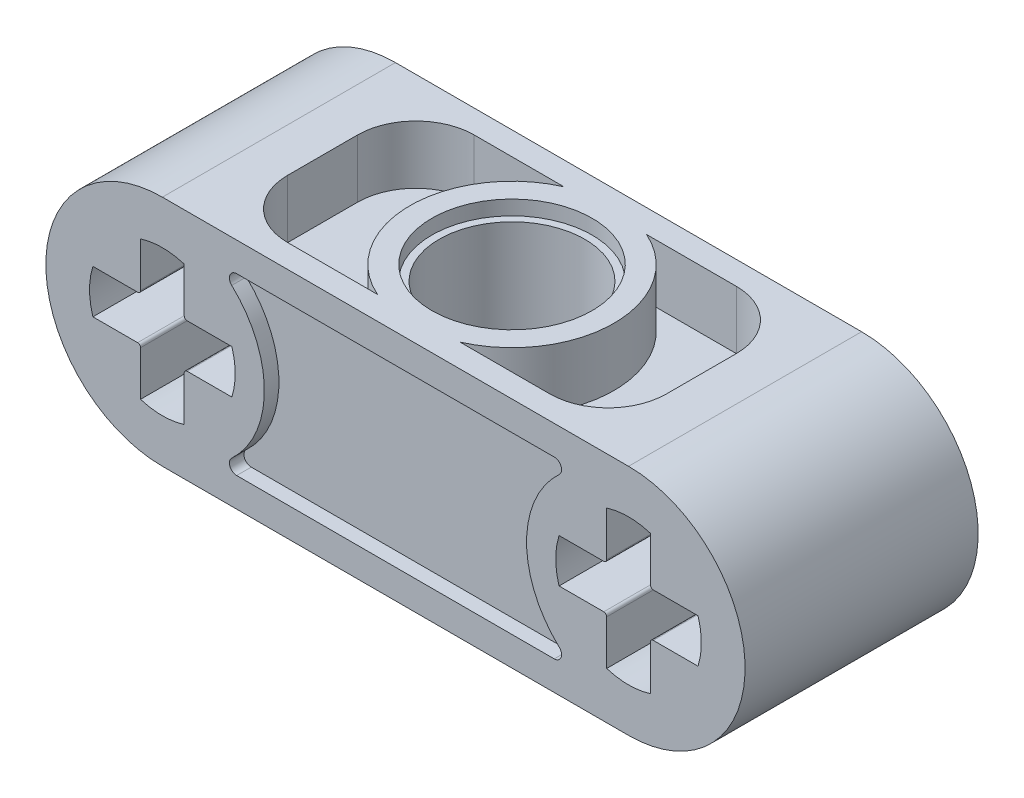
from build123d import *

# Parameters (mm, degrees)
EXTRUIR1_DEPTH         = 4
CROQUIS2_R             = 2.5
CORTAR_EXTRUIR1_DEPTH  = 15.966629547
CROQUIS3_R             = 2.75
CORTAR_EXTRUIR2_DEPTH  = 0.5
CORTAR_EXTRUIR3_DEPTH  = 2
SIMETR_A3_COPY_1_DEPTH = 2
REDONDEO1_R            = 2
CORTAR_EXTRUIR4_DEPTH  = 0.5


with BuildPart() as part:
    # Croquis1 → Extruir1 (new, symmetric)
    with BuildSketch(Plane.XY):
        with BuildLine():
            Line((-8, 4), (8, 4))
            ThreePointArc((8, 4), (12, 0), (8, -4))
            Line((8, -4), (-8, -4))
            ThreePointArc((-8, -4), (-12, 0), (-8, 4))
        make_face()
        with BuildLine():
            Line((10.384848004, -0.75), (8.85, -0.75))
            ThreePointArc((8.85, -0.75), (8.779289322, -0.779289322), (8.75, -0.85))
            Line((8.75, -0.85), (8.75, -2.384848004))
            ThreePointArc((8.75, -2.384848004), (8, -2.5), (7.25, -2.384848004))
            Line((7.25, -2.384848004), (7.25, -0.85))
            ThreePointArc((7.25, -0.85), (7.220710678, -0.779289322), (7.15, -0.75))
            Line((7.15, -0.75), (5.615151996, -0.75))
            ThreePointArc((5.615151996, -0.75), (5.5, 0), (5.615151996, 0.75))
            Line((5.615151996, 0.75), (7.15, 0.75))
            ThreePointArc((7.15, 0.75), (7.220710678, 0.779289322), (7.25, 0.85))
            Line((7.25, 0.85), (7.25, 2.384848004))
            ThreePointArc((7.25, 2.384848004), (8, 2.5), (8.75, 2.384848004))
            Line((8.75, 2.384848004), (8.75, 0.85))
            ThreePointArc((8.75, 0.85), (8.779289322, 0.779289322), (8.85, 0.75))
            Line((8.85, 0.75), (10.384848004, 0.75))
            ThreePointArc((10.384848004, 0.75), (10.5, 0), (10.384848004, -0.75))
        make_face(mode=Mode.SUBTRACT)
        with BuildLine():
            Line((-10.384848004, 0.75), (-8.85, 0.75))
            ThreePointArc((-8.85, 0.75), (-8.779289322, 0.779289322), (-8.75, 0.85))
            Line((-8.75, 0.85), (-8.75, 2.384848004))
            ThreePointArc((-8.75, 2.384848004), (-8, 2.5), (-7.25, 2.384848004))
            Line((-7.25, 2.384848004), (-7.25, 0.85))
            ThreePointArc((-7.25, 0.85), (-7.220710678, 0.779289322), (-7.15, 0.75))
            Line((-7.15, 0.75), (-5.615151996, 0.75))
            ThreePointArc((-5.615151996, 0.75), (-5.5, 0), (-5.615151996, -0.75))
            Line((-5.615151996, -0.75), (-7.15, -0.75))
            ThreePointArc((-7.15, -0.75), (-7.220710678, -0.779289322), (-7.25, -0.85))
            Line((-7.25, -0.85), (-7.25, -2.384848004))
            ThreePointArc((-7.25, -2.384848004), (-8, -2.5), (-8.75, -2.384848004))
            Line((-8.75, -2.384848004), (-8.75, -0.85))
            ThreePointArc((-8.75, -0.85), (-8.779289322, -0.779289322), (-8.85, -0.75))
            Line((-8.85, -0.75), (-10.384848004, -0.75))
            ThreePointArc((-10.384848004, -0.75), (-10.5, 0), (-10.384848004, 0.75))
        make_face(mode=Mode.SUBTRACT)
    extrude(amount=EXTRUIR1_DEPTH, both=True)

    # Croquis2 → Cortar-Extruir1 (cut, through all)
    with BuildSketch(Plane(origin=(0, 4, 0), x_dir=(-1, 0, 0), z_dir=(0, 1, 0))):
        with Locations(Location((0, 0, 0), (0, 0, 90))):
            Circle(CROQUIS2_R)
    extrude(amount=-CORTAR_EXTRUIR1_DEPTH, mode=Mode.SUBTRACT)

    # Croquis3 → Cortar-Extruir2 (cut)
    with BuildSketch(Plane(origin=(0, 4, 0), x_dir=(-1, 0, 0), z_dir=(0, 1, 0))):
        with Locations(Location((0, 0, 0), (0, 0, 90))):
            Circle(CROQUIS3_R)
    cortar_extruir2 = extrude(amount=-CORTAR_EXTRUIR2_DEPTH, mode=Mode.SUBTRACT)

    # Simetría1: Cortar-Extruir2 across plane
    add(cortar_extruir2.mirror(Plane.ZX), mode=Mode.SUBTRACT)

    # Croquis4 → Cortar-Extruir3 (cut)
    with BuildSketch(Plane(origin=(0, 4, 0), x_dir=(-1, 0, 0), z_dir=(0, 1, 0))):
        with BuildLine():
            Line((-1.417744688, -3.2), (-6.5, -3.2))
            Line((-6.5, -3.2), (-6.5, 3.2))
            Line((-6.5, 3.2), (-1.417744688, 3.2))
            ThreePointArc((-1.417744688, 3.2), (-3.5, 0), (-1.417744688, -3.2))
        make_face()
    cortar_extruir3 = extrude(amount=-CORTAR_EXTRUIR3_DEPTH, mode=Mode.SUBTRACT)

    # Simetría2: Cortar-Extruir3 across plane
    add(cortar_extruir3.mirror(Plane(origin=(0, 0, 0), x_dir=(0, 0, 1), z_dir=(1, 0, 0))), mode=Mode.SUBTRACT)

    # Simetría3: Cortar-Extruir3 across plane
    add(cortar_extruir3.mirror(Plane.ZX), mode=Mode.SUBTRACT)

    # Simetría3 copy 1 sketch → Simetría3 copy 1 (cut)
    with BuildSketch(Plane.XZ.offset(4)):
        with BuildLine():
            Line((-1.417744688, -3.2), (-6.5, -3.2))
            Line((-6.5, -3.2), (-6.5, 3.2))
            Line((-6.5, 3.2), (-1.417744688, 3.2))
            ThreePointArc((-1.417744688, 3.2), (-3.5, 0), (-1.417744688, -3.2))
        make_face()
    extrude(amount=-SIMETR_A3_COPY_1_DEPTH, mode=Mode.SUBTRACT)

    # Redondeo1
    redondeo1_edges = [part.edges().sort_by_distance(p)[0] for p in [
        (6.5, 3, -3.2),
        (6.5, 3, 3.2),
        (-6.5, 3, 3.2),
        (-6.5, 3, -3.2),
        (-6.5, -3, -3.2),
        (-6.5, -3, 3.2),
        (6.5, -3, 3.2),
        (6.5, -3, -3.2),
    ]]
    fillet(redondeo1_edges, radius=REDONDEO1_R)

    # Croquis5 → Cortar-Extruir4 (cut)
    with BuildSketch(Plane.XY.offset(4)):
        with BuildLine():
            Line((-5.450490243, 3), (5.450490243, 3))
            ThreePointArc((5.450490243, 3), (5.683227577, 2.841287093), (5.62045756, 2.566666667))
            ThreePointArc((5.62045756, 2.566666667), (4.5, 0), (5.62045756, -2.566666667))
            ThreePointArc((5.62045756, -2.566666667), (5.683227577, -2.841287093), (5.450490243, -3))
            Line((5.450490243, -3), (-5.450490243, -3))
            ThreePointArc((-5.450490243, -3), (-5.683227577, -2.841287093), (-5.62045756, -2.566666667))
            ThreePointArc((-5.62045756, -2.566666667), (-4.5, 0), (-5.62045756, 2.566666667))
            ThreePointArc((-5.62045756, 2.566666667), (-5.683227577, 2.841287093), (-5.450490243, 3))
        make_face()
    cortar_extruir4 = extrude(amount=-CORTAR_EXTRUIR4_DEPTH, mode=Mode.SUBTRACT)

    # Simetría4: Cortar-Extruir4 across plane
    add(cortar_extruir4.mirror(Plane.XY), mode=Mode.SUBTRACT)


solid = part.part
